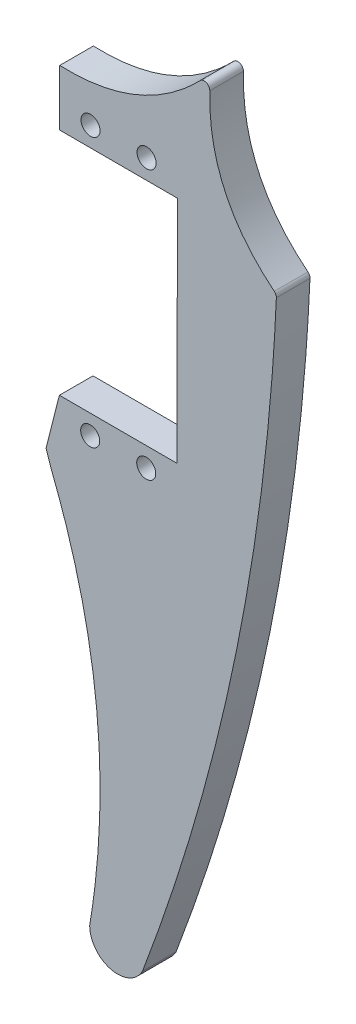
from build123d import *

# Parameters (mm, degrees)
SKETCH1_W           = 50
SKETCH1_H           = 146
BOSS_EXTRUDE1_DEPTH = 6
SKETCH3_W           = 50
SKETCH3_H           = 146
SKETCH3_R           = 1.7
CUT_EXTRUDE1_DEPTH  = 78.395090284


with BuildPart() as part:
    # Sketch1 → Boss-Extrude1 (new body)
    with BuildSketch(Plane.XY):
        Rectangle(SKETCH1_W, SKETCH1_H)
    extrude(amount=BOSS_EXTRUDE1_DEPTH)

    # Sketch3 → Cut-Extrude1 (cut, through all)
    # profile 1 of 5: a face of its own
    with BuildSketch(Plane.XY.offset(6)):
        Rectangle(SKETCH3_W, SKETCH3_H)
        with BuildLine():
            Line((-18.157666585, 62.461107324), (-18.169843297, 52.461114738))
            Line((-18.169843297, 52.461114738), (2.830141135, 52.435543643))
            Line((2.830141135, 52.435543643), (2.780216616, 11.435574039))
            Line((2.780216616, 11.435574039), (-18.219767816, 11.461145134))
            Line((-18.219767816, 11.461145134), (-20.602879389, 2.095244868))
            add(Edge.make_bspline(
                [(-20.602879389, 2.095244868), (-20.020523896, 0.117608734), (-18.597491452, -3.334331588), (-16.904181184, -8.263198364), (-15.595665152, -12.546131745), (-14.456132729, -16.810408344), (-13.502980015, -20.975707084), (-12.475078727, -26.375577077), (-11.593046993, -32.660410116), (-10.802512336, -42.889860589), (-11.008756714, -54.642065179), (-12.153104447, -63.838427604), (-12.816272335, -67.795493305)],
                knots=[0, 0, 0, 0, 0.086646204, 0.157135059, 0.219373113, 0.275194629, 0.342966262, 0.399251523, 0.506628072, 0.609997758, 0.831095498, 1, 1, 1, 1], degree=3))
            ThreePointArc((-12.816272335, -67.795493305), (-9.012812454, -72.656301077), (-3.386129771, -70.119728338))
            add(Edge.make_bspline(
                [(-3.386129771, -70.119728338), (-2.21747594, -67.029455897), (-0.182430908, -61.43213239), (2.320638839, -54.010869169), (4.39612593, -47.471958806), (6.084233389, -41.826754396), (7.773371334, -35.827923865), (9.314485553, -30.006285299), (10.847177653, -23.777350088), (12.248531309, -17.633995633), (13.38184099, -12.246243723), (14.445923409, -6.813215488), (15.450948646, -1.273466268), (16.541323936, 5.397802811), (17.525796818, 12.227452617), (18.318292736, 18.577526245), (18.968243317, 24.556005739), (19.546819221, 30.747357743), (20.091144312, 37.979656821), (20.373774924, 43.153327808), (20.493418189, 45.880508448)],
                knots=[0, 0, 0, 0, 0.083335097, 0.150214343, 0.197536109, 0.256374009, 0.298827669, 0.354728647, 0.408266597, 0.460622921, 0.513659664, 0.547132194, 0.600265327, 0.655665944, 0.717630207, 0.774302923, 0.817071636, 0.86931356, 0.9311449, 1, 1, 1, 1], degree=3))
            ThreePointArc((20.493418189, 45.880508448), (20.406083271, 46.335184873), (20.123317244, 46.701792855))
            add(Edge.make_bspline(
                [(8.617522303, 71.930046937), (8.590710324, 70.931587333), (8.616247935, 68.508726225), (8.97509159, 65.334163001), (9.675355593, 62.166917416), (10.407826162, 59.878461992), (11.375637803, 57.567082564), (12.476705695, 55.420888781), (13.985734658, 53.073760845), (15.699091005, 50.90924769), (17.727100256, 48.757794454), (19.223608489, 47.429602703), (20.123317244, 46.701792855)],
                knots=[0, 0, 0, 0, 0.10400348, 0.252210124, 0.331596335, 0.441573044, 0.501852928, 0.592428261, 0.692389888, 0.791956146, 0.879471991, 1, 1, 1, 1], degree=3))
            ThreePointArc((8.617522303, 71.930046937), (8.006083211, 72.878510262), (6.900295351, 72.653402178))
            add(Edge.make_bspline(
                [(-18.157666585, 62.461107324), (-16.595787428, 62.40054525), (-13.772759201, 62.464261258), (-9.697592278, 63.074582136), (-6.3235109, 64.014176015), (-3.330757616, 65.219156255), (-0.94481153, 66.454321846), (1.113119903, 67.745229422), (3.761030335, 69.658518488), (5.631814544, 71.346079367), (6.900295351, 72.653402178)],
                knots=[0, 0, 0, 0, 0.167942372, 0.302841242, 0.441808799, 0.543310726, 0.649111052, 0.730099181, 0.804199887, 1, 1, 1, 1], degree=3))
        make_face(mode=Mode.SUBTRACT)
    # profile 2 of 5: a face of its own
    with BuildSketch(Plane.XY.offset(6)):
        with Locations((-12.724033742, 7.954450537)):
            Circle(SKETCH3_R)
    # profile 3 of 5: a face of its own
    with BuildSketch(Plane.XY.offset(6)):
        with Locations((-2.724041156, 7.942273825)):
            Circle(SKETCH3_R)
    # profile 4 of 5: a face of its own
    with BuildSketch(Plane.XY.offset(6)):
        with Locations((-12.665585525, 55.954414952)):
            Circle(SKETCH3_R)
    # profile 5 of 5: a face of its own
    with BuildSketch(Plane.XY.offset(6)):
        with Locations((-2.665592939, 55.94223824)):
            Circle(SKETCH3_R)
    extrude(amount=-CUT_EXTRUDE1_DEPTH, mode=Mode.SUBTRACT)


solid = part.part
